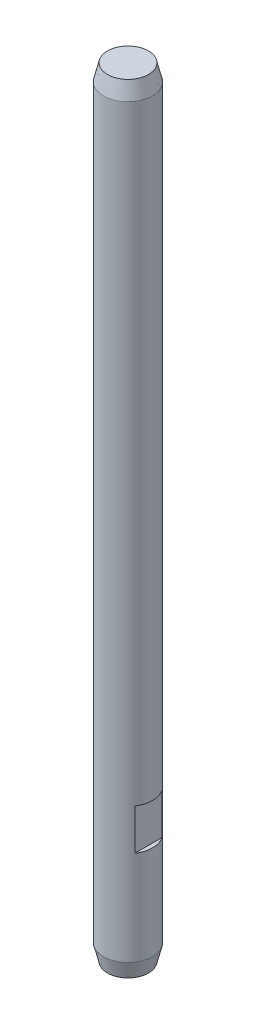
from build123d import *

# Parameters (mm, degrees)
SKETCH1_R           = 3
BOSS_EXTRUDE1_DEPTH = 95
CHAMFER1_SIZE       = 0.5
CHAMFER1_SIZE2      = 2
CHAMFER2_SIZE       = 2
CHAMFER2_SIZE2      = 0.5
SKETCH2_W           = 6
SKETCH2_H           = 5
CUT_EXTRUDE1_DEPTH  = 0.5


with BuildPart() as part:
    # Sketch1 → Boss-Extrude1 (new body)
    with BuildSketch(Plane(origin=(0, 0, 0), x_dir=(1, 0, 0), z_dir=(0, 1, 0))):
        with Locations(Location((0, 0, 0), (0, 0, 270))):
            Circle(SKETCH1_R)
    extrude(amount=BOSS_EXTRUDE1_DEPTH)

    # Chamfer1
    chamfer1_edges = [part.edges().sort_by_distance(p)[0] for p in [
        (0, 0, -3),
    ]]
    chamfer1_side = [part.faces().sort_by_distance(p)[0] for p in [
        (0, 0, 0),
    ]]
    chamfer(chamfer1_edges, length=CHAMFER1_SIZE, length2=CHAMFER1_SIZE2, reference=chamfer1_side[0])

    # Chamfer2
    chamfer2_edges = [part.edges().sort_by_distance(p)[0] for p in [
        (0, 95, -3),
    ]]
    chamfer2_side = [part.faces().sort_by_distance(p)[0] for p in [
        (0, 48.5, -3),
    ]]
    chamfer(chamfer2_edges, length=CHAMFER2_SIZE, length2=CHAMFER2_SIZE2, reference=chamfer2_side[0])

    # Sketch2 → Cut-Extrude1 (cut)
    with BuildSketch(Plane(origin=(3, 0, 0), x_dir=(0, 0, -1), z_dir=(1, 0, 0))):
        with Locations((0, 16)):
            Rectangle(SKETCH2_W, SKETCH2_H)
    extrude(amount=-CUT_EXTRUDE1_DEPTH, mode=Mode.SUBTRACT)


solid = part.part
